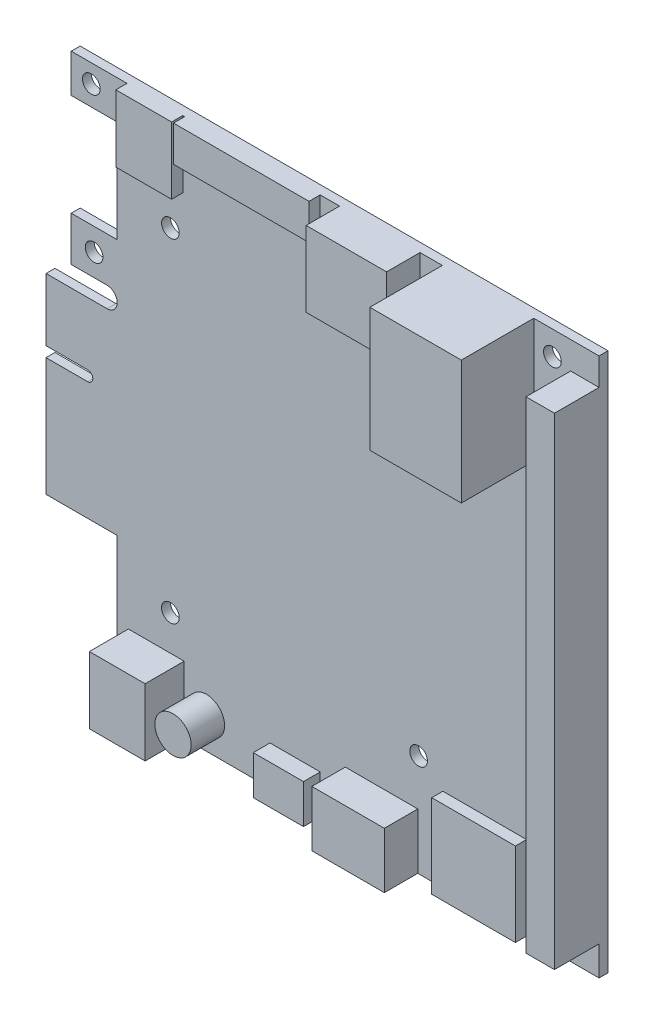
from build123d import *

# Parameters (mm, degrees)
SKETCH_1_R       = 1.585
EXTRUDE_1_DEPTH  = 1.6
SKETCH_2_W       = 5.1
SKETCH_2_H       = 86.4
EXTRUDE_2_DEPTH  = 8
SKETCH_3_W       = 16.4
SKETCH_3_H       = 22.2
EXTRUDE_3_DEPTH  = 13
SKETCH_4_W       = 14.42
SKETCH_4_H       = 13.5
EXTRUDE_4_DEPTH  = 6
SKETCH_5_W       = 24.3
SKETCH_5_H       = 6.4
EXTRUDE_5_DEPTH  = 2
SKETCH_6_W       = 10
SKETCH_6_H       = 12
EXTRUDE_6_DEPTH  = 2
SKETCH_7_W       = 15
SKETCH_7_H       = 15
EXTRUDE_7_DEPTH  = 2
SKETCH_8_W       = 13
SKETCH_8_H       = 10
EXTRUDE_8_DEPTH  = 6
SKETCH_9_W       = 9
SKETCH_9_H       = 7
EXTRUDE_9_DEPTH  = 3
SKETCH_10_W      = 10
SKETCH_10_H      = 12
EXTRUDE_10_DEPTH = 7
SKETCH_11_R      = 3.25
EXTRUDE_11_DEPTH = 6
SKETCH_12_W      = 14.7
SKETCH_12_H      = 4.6
SKETCH_12_W_2    = 5
SKETCH_12_H_2    = 23.9
EXTRUDE_12_DEPTH = 2
SKETCH_14_W      = 5
SKETCH_14_H      = 4
SKETCH_14_W_2    = 2
EXTRUDE_13_DEPTH = 2


with BuildPart() as part:
    # 草图1 → 凸台-拉伸1 (new body)
    with BuildSketch(Plane.XY):
        with BuildLine():
            Line((81.28, 82.72), (-13.36, 82.72))
            Line((-13.36, 82.72), (-13.36, 75.84))
            Line((-13.36, 75.84), (-5.19, 75.84))
            Line((-5.19, 75.84), (-5.19, 57.56))
            Line((-5.19, 57.56), (-13.36, 57.56))
            Line((-13.36, 57.56), (-13.36, 49.59))
            Line((-13.36, 49.59), (-6.94, 49.59))
            ThreePointArc((-6.94, 49.59), (-5.115, 47.765), (-6.94, 45.94))
            Line((-6.94, 45.94), (-17.88, 45.94))
            Line((-17.88, 45.94), (-17.88, 34.72))
            Line((-17.88, 34.72), (-10.42, 34.72))
            ThreePointArc((-10.42, 34.72), (-9.495, 33.795), (-10.42, 32.87))
            Line((-10.42, 32.87), (-17.88, 32.87))
            Line((-17.88, 32.87), (-17.88, 11.64))
            Line((-17.88, 11.64), (-5.11, 11.64))
            Line((-5.11, 11.64), (-5.11, -13.88))
            Line((-5.11, -13.88), (81.28, -13.88))
            Line((81.28, -13.88), (81.28, 82.72))
        make_face()
        with Locations((48.92, 64.16)):
            Circle(SKETCH_1_R, mode=Mode.SUBTRACT)
        with Locations((4.42, 64.16)):
            Circle(SKETCH_1_R, mode=Mode.SUBTRACT)
        with Locations((4.42, 4.42)):
            Circle(SKETCH_1_R, mode=Mode.SUBTRACT)
        with Locations((48.92, 4.42)):
            Circle(SKETCH_1_R, mode=Mode.SUBTRACT)
        with Locations((72.92, -9.58)):
            Circle(SKETCH_1_R, mode=Mode.SUBTRACT)
        with Locations((72.92, 78.42)):
            Circle(SKETCH_1_R, mode=Mode.SUBTRACT)
        with Locations((-9.76, 79.42)):
            Circle(SKETCH_1_R, mode=Mode.SUBTRACT)
        with Locations((-9.26, 53.56)):
            Circle(SKETCH_1_R, mode=Mode.SUBTRACT)
    extrude(amount=EXTRUDE_1_DEPTH)

    # 草图2 → 凸台-拉伸2 (add)
    with BuildSketch(Plane.XY.offset(1.6)):
        with Locations((78.73, 34.62)):
            Rectangle(SKETCH_2_W, SKETCH_2_H)
    extrude(amount=EXTRUDE_2_DEPTH)

    # 草图3 → 凸台-拉伸3 (add)
    with BuildSketch(Plane.XY.offset(1.6)):
        with Locations((61.38, 71.62)):
            Rectangle(SKETCH_3_W, SKETCH_3_H)
    extrude(amount=EXTRUDE_3_DEPTH)

    # 草图4 → 凸台-拉伸4 (add)
    with BuildSketch(Plane.XY.offset(1.6)):
        with Locations((41.97, 75.97)):
            Rectangle(SKETCH_4_W, SKETCH_4_H)
    extrude(amount=EXTRUDE_4_DEPTH)

    # 草图5 → 凸台-拉伸5 (add)
    with BuildSketch(Plane.XY.offset(1.6)):
        with Locations((19.13, 79.52)):
            Rectangle(SKETCH_5_W, SKETCH_5_H)
    extrude(amount=EXTRUDE_5_DEPTH)

    # 草图6 → 凸台-拉伸6 (add)
    with BuildSketch(Plane.XY.offset(1.6)):
        with Locations((1.64, 76.72)):
            Rectangle(SKETCH_6_W, SKETCH_6_H)
    extrude(amount=EXTRUDE_6_DEPTH)

    # 草图7 → 凸台-拉伸7 (add)
    with BuildSketch(Plane.XY.offset(1.6)):
        with Locations((60.78, -6.38)):
            Rectangle(SKETCH_7_W, SKETCH_7_H)
    extrude(amount=EXTRUDE_7_DEPTH)

    # 草图8 → 凸台-拉伸8 (add)
    with BuildSketch(Plane.XY.offset(1.6)):
        with Locations((42.28, -8.88)):
            Rectangle(SKETCH_8_W, SKETCH_8_H)
    extrude(amount=EXTRUDE_8_DEPTH)

    # 草图9 → 凸台-拉伸9 (add)
    with BuildSketch(Plane.XY.offset(1.6)):
        with Locations((26.78, -10.38)):
            Rectangle(SKETCH_9_W, SKETCH_9_H)
    extrude(amount=EXTRUDE_9_DEPTH)

    # 草图10 → 凸台-拉伸10 (add)
    with BuildSketch(Plane.XY.offset(1.6)):
        with Locations((1.89, -7.88)):
            Rectangle(SKETCH_10_W, SKETCH_10_H)
    extrude(amount=EXTRUDE_10_DEPTH)

    # 草图11 → 凸台-拉伸11 (add)
    with BuildSketch(Plane.XY.offset(1.6)):
        with Locations((10.89, -8.28)):
            Circle(SKETCH_11_R)
    extrude(amount=EXTRUDE_11_DEPTH)

    # 草图12 → 凸台-拉伸12 (add)
    with BuildSketch(Plane(origin=(0, 0, 0), x_dir=(-1, 0, 0), z_dir=(0, 0, -1))):
        with Locations((-61.83, 12.42)):
            Rectangle(SKETCH_12_W, SKETCH_12_H)
        with Locations((-9.78, 25.07)):
            Rectangle(SKETCH_12_W_2, SKETCH_12_H_2)
    extrude(amount=EXTRUDE_12_DEPTH)

    # 草图14 → 凸台-拉伸13 (add)
    with BuildSketch(Plane(origin=(0, 0, 0), x_dir=(-1, 0, 0), z_dir=(0, 0, -1))):
        with Locations((-10.39, -8.88)):
            Rectangle(SKETCH_14_W, SKETCH_14_H)
        with Locations((-20.89, -1.88)):
            Rectangle(SKETCH_14_W_2, SKETCH_14_H)
    extrude(amount=EXTRUDE_13_DEPTH)


solid = part.part
